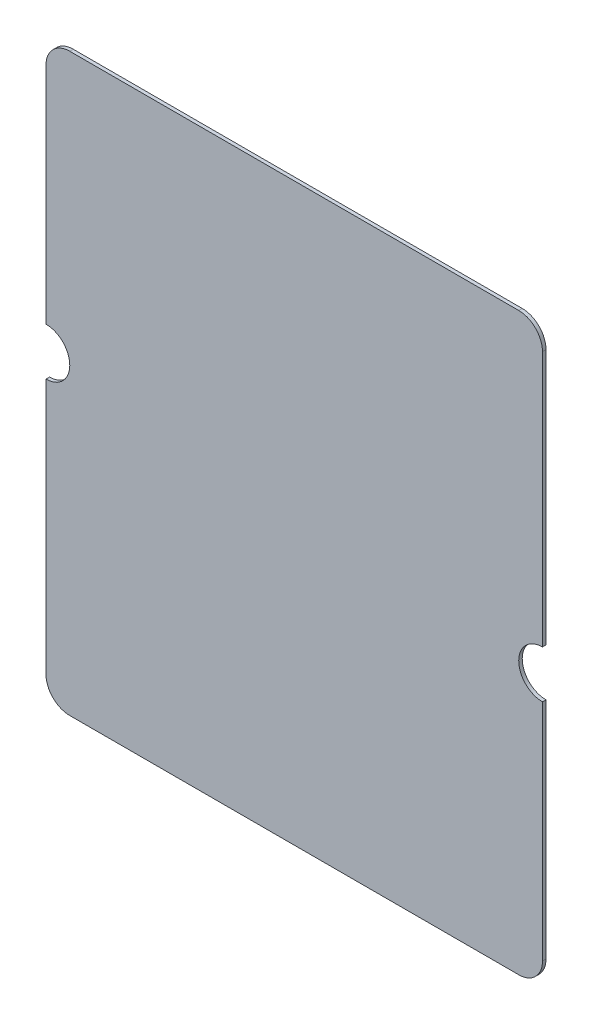
from build123d import *

# Parameters (mm, degrees)
BOSS_EXTRUDE1_DEPTH = 1.4


with BuildPart() as part:
    # Sketch2 → Boss-Extrude1 (new body)
    with BuildSketch(Plane.XY):
        with BuildLine():
            Line((9.5, 0), (189, 0))
            ThreePointArc((189, 0), (195.717514421, 2.782485579), (198.5, 9.5))
            Line((198.5, 9.5), (198.5, 99.25))
            ThreePointArc((198.5, 99.25), (189, 108.75), (198.5, 118.25))
            Line((198.5, 118.25), (198.5, 220.52))
            ThreePointArc((198.5, 220.52), (195.717514421, 227.237514421), (189, 230.02))
            Line((189, 230.02), (9.5, 230.02))
            ThreePointArc((9.5, 230.02), (2.782485579, 227.237514421), (0, 220.52))
            Line((0, 220.52), (0, 130.77))
            ThreePointArc((0, 130.77), (9.5, 121.27), (0, 111.77))
            Line((0, 111.77), (0, 9.5))
            ThreePointArc((0, 9.5), (2.782485579, 2.782485579), (9.5, 0))
        make_face()
    extrude(amount=BOSS_EXTRUDE1_DEPTH)


solid = part.part
